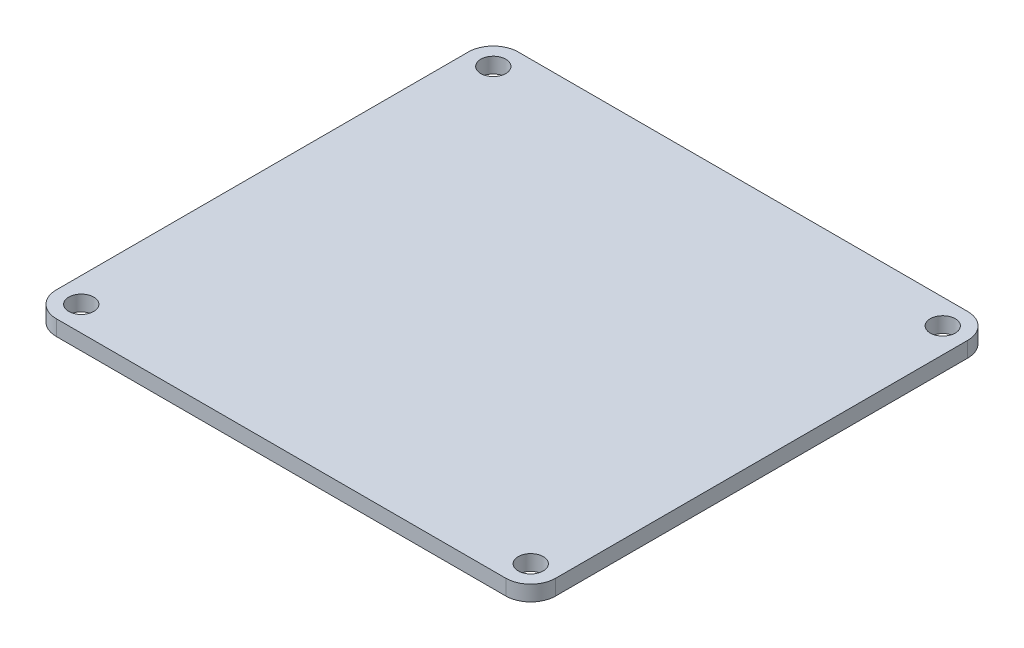
from build123d import *

# Parameters (mm, degrees)
SKETCH1_W                = 50.8
SKETCH1_H                = 46.99
BOSS_EXTRUDE1_DEPTH      = 1.57
F_1_16_0_1_DOWEL_HOLE1_D = 2.54
CUT_EXTRUDE1_DEPTH       = 35.635818526


with BuildPart() as part:
    # Sketch1 → Boss-Extrude1 (new body)
    with BuildSketch(Plane(origin=(0, 0, 0), x_dir=(1, 0, 0), z_dir=(0, 1, 0))):
        Rectangle(SKETCH1_W, SKETCH1_H)
    extrude(amount=BOSS_EXTRUDE1_DEPTH)

    # 1/16 (0.1) Dowel Hole1 (through all)
    with Locations(Plane(origin=(-22.86, 1.57, -20.955), x_dir=(0, 0, 1), z_dir=(0, 1, 0))):
        with Locations((0, 0), (0, 45.72), (41.91, 45.72), (41.91, 0)):
            Hole(F_1_16_0_1_DOWEL_HOLE1_D / 2)

    # Sketch2 → Cut-Extrude1 (cut, through all)
    with BuildSketch(Plane(origin=(0, 1.57, 0), x_dir=(1, 0, 0), z_dir=(0, 1, 0))):
        with BuildLine():
            Line((-25.4, 23.495), (-25.4, 20.955))
            ThreePointArc((-25.4, 20.955), (-24.656051224, 22.751051224), (-22.86, 23.495))
            Line((-22.86, 23.495), (-25.4, 23.495))
        make_face()
        with BuildLine():
            Line((25.4, 23.495), (22.86, 23.495))
            ThreePointArc((22.86, 23.495), (24.656051224, 22.751051224), (25.4, 20.955))
            Line((25.4, 20.955), (25.4, 23.495))
        make_face()
        with BuildLine():
            ThreePointArc((25.4, -20.955), (24.656051224, -22.751051224), (22.86, -23.495))
            Line((22.86, -23.495), (25.4, -23.495))
            Line((25.4, -23.495), (25.4, -20.955))
        make_face()
        with BuildLine():
            ThreePointArc((-22.86, -23.495), (-24.656051224, -22.751051224), (-25.4, -20.955))
            Line((-25.4, -20.955), (-25.4, -23.495))
            Line((-25.4, -23.495), (-22.86, -23.495))
        make_face()
    extrude(amount=-CUT_EXTRUDE1_DEPTH, mode=Mode.SUBTRACT)


solid = part.part
